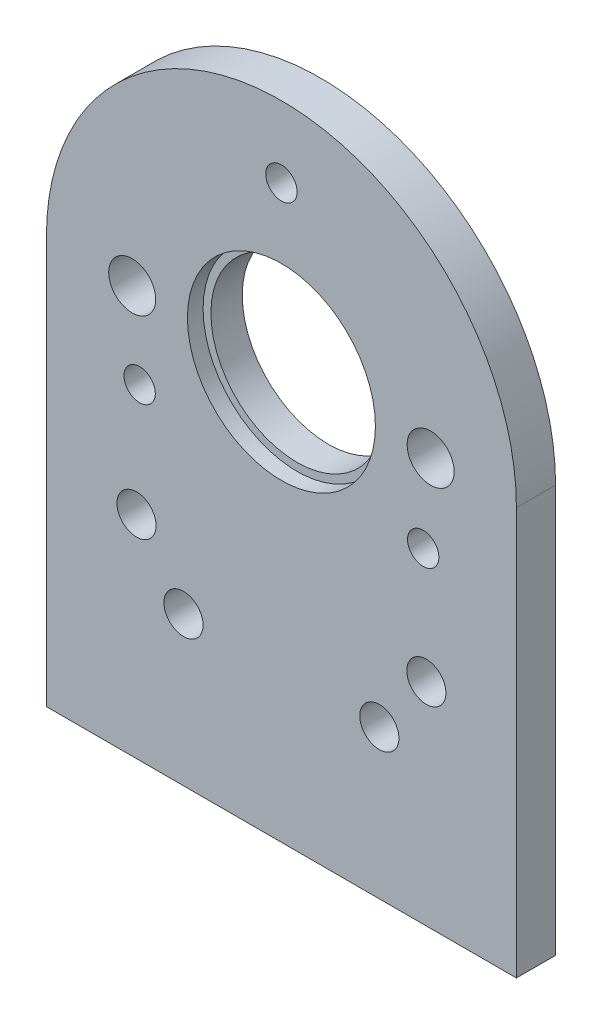
from build123d import *

# Parameters (mm, degrees)
BOSS_EXTRUDE1_DEPTH                      = 2.5
BOSS_EXTRUDE2_DEPTH                      = 0.5
F_2_5_2_5_DIAMETER_HOLE1_D               = 2.5
F_3_0_3_DIAMETER_HOLE1_D                 = 3
F_2_0_2_DIAMETER_HOLE1_D                 = 2
CBORE_FOR_M10_HEX_HEAD_BOLT1_D           = 11
CBORE_FOR_M10_HEX_HEAD_BOLT1_CBORE_D     = 12
CBORE_FOR_M10_HEX_HEAD_BOLT1_CBORE_DEPTH = 1


with BuildPart() as part:
    # Sketch1 → Boss-Extrude1 (new body)
    with BuildSketch(Plane.XY.offset(3)):
        with BuildLine():
            Line((-15, 0), (-15, -26))
            Line((-15, -26), (15, -26))
            Line((15, -26), (15, 0))
            ThreePointArc((15, 0), (0, 15), (-15, 0))
        make_face()
    extrude(amount=-BOSS_EXTRUDE1_DEPTH)

    # Sketch2 → Boss-Extrude2 (add)
    with BuildSketch(Plane(origin=(0, 0, 0.5), x_dir=(-1, 0, 0), z_dir=(0, 0, -1))):
        with BuildLine():
            Line((-14.25, -25.25), (-14.25, 0))
            ThreePointArc((-14.25, 0), (0, 14.25), (14.25, 0))
            Line((14.25, 0), (14.25, -25.25))
            Line((14.25, -25.25), (-14.25, -25.25))
        make_face()
    extrude(amount=BOSS_EXTRUDE2_DEPTH)

    # Ø2.5 (2.5) Diameter Hole1 (through all)
    with Locations(Plane(origin=(0, 0, 0), x_dir=(-1, 0, 0), z_dir=(0, 0, -1))):
        with Locations((9.25, -12.5), (-9.25, -12.5), (6.25, -16.5), (-6.25, -16.5)):
            Hole(F_2_5_2_5_DIAMETER_HOLE1_D / 2)

    # Ø3.0 (3) Diameter Hole1 (through all)
    with Locations(Plane(origin=(0, 0, 0), x_dir=(-1, 0, 0), z_dir=(0, 0, -1))):
        with Locations((-9.525, 0), (9.525, 0)):
            Hole(F_3_0_3_DIAMETER_HOLE1_D / 2)

    # Ø2.0 (2) Diameter Hole1 (through all)
    with Locations(Plane(origin=(0, 0, 0), x_dir=(-1, 0, 0), z_dir=(0, 0, -1))):
        with Locations((0, 10.45), (9.04996547, -5.225), (-9.04996547, -5.225)):
            Hole(F_2_0_2_DIAMETER_HOLE1_D / 2)

    # CBORE for M10 Hex Head Bolt1 (through all)
    with Locations(Plane.XY.offset(3)):
        with Locations((0, 0)):
            CounterBoreHole(CBORE_FOR_M10_HEX_HEAD_BOLT1_D / 2, CBORE_FOR_M10_HEX_HEAD_BOLT1_CBORE_D / 2, CBORE_FOR_M10_HEX_HEAD_BOLT1_CBORE_DEPTH)


solid = part.part
